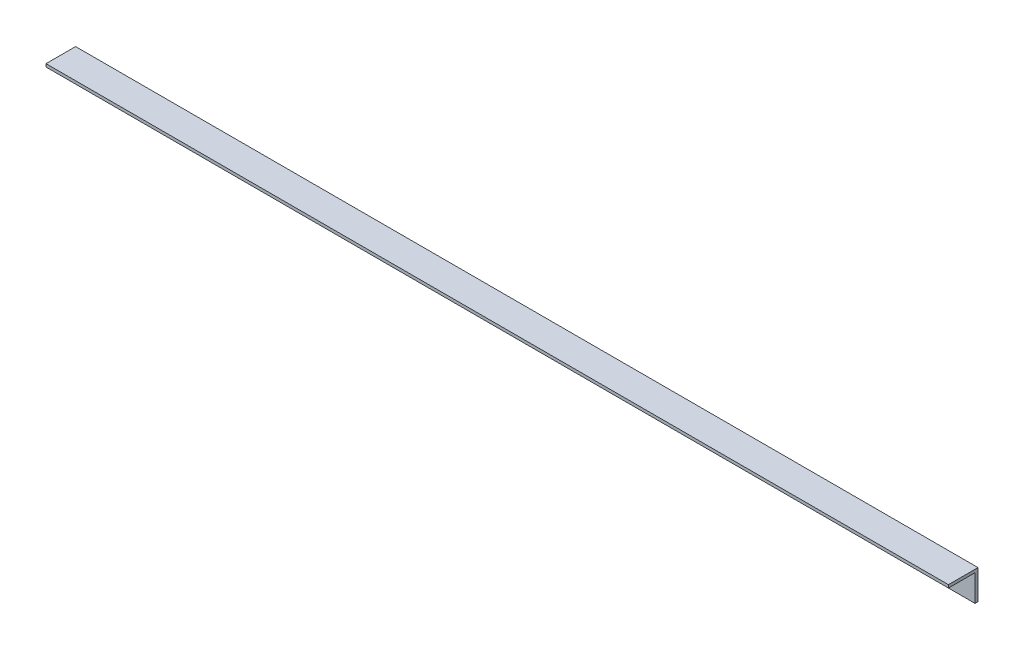
from build123d import *

# Parameters (mm, degrees)
ESQUISSE1_W        = 610
ESQUISSE1_H        = 20
BOSS_EXTRU_1_DEPTH = 2
ESQUISSE2_W        = 610
ESQUISSE2_H        = 2
BOSS_EXTRU_2_DEPTH = 18


with BuildPart() as part:
    # Esquisse1 → Boss.-Extru.1 (new body)
    with BuildSketch(Plane.XY):
        with Locations((305, 10)):
            Rectangle(ESQUISSE1_W, ESQUISSE1_H)
    extrude(amount=BOSS_EXTRU_1_DEPTH)

    # Esquisse2 → Boss.-Extru.2 (add)
    with BuildSketch(Plane.XY.offset(2)):
        with Locations((305, 19)):
            Rectangle(ESQUISSE2_W, ESQUISSE2_H)
    extrude(amount=BOSS_EXTRU_2_DEPTH)


solid = part.part
